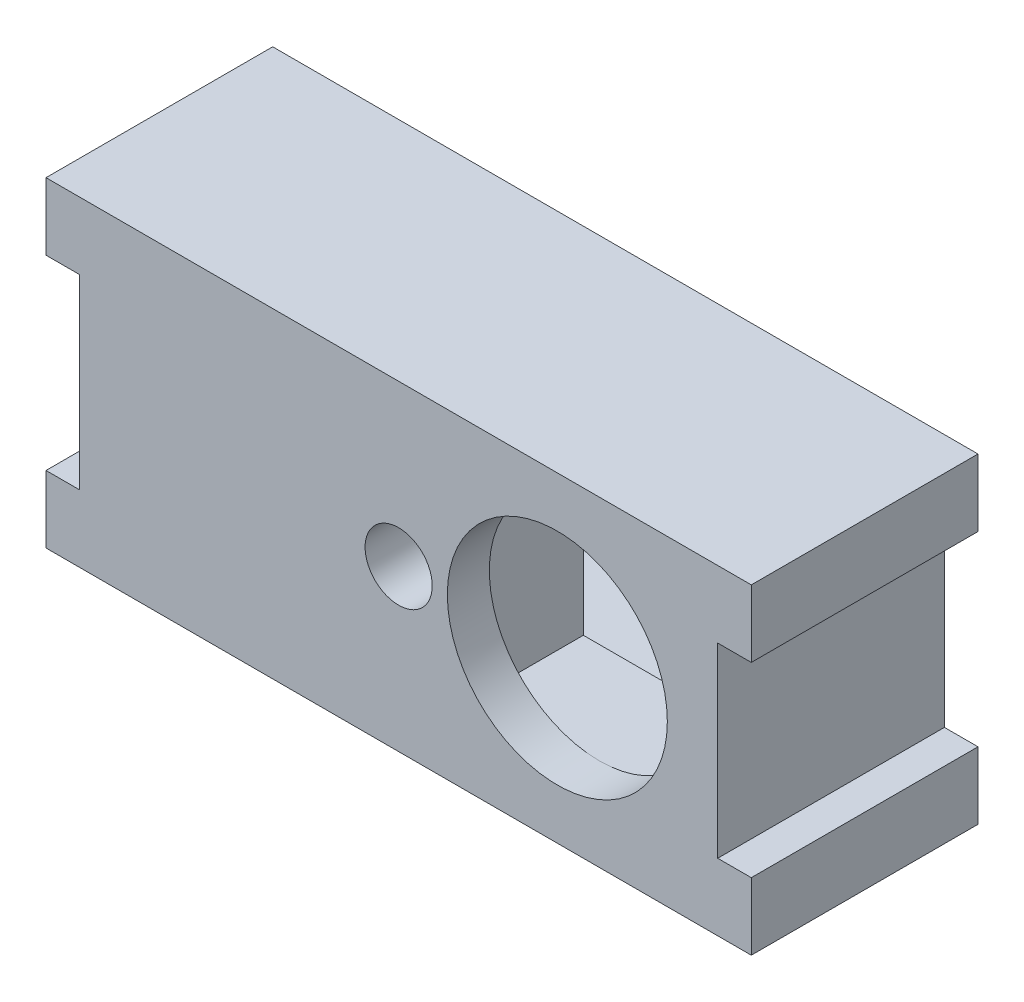
from build123d import *

# Parameters (mm, degrees)
SKETCH2_W           = 38
SKETCH2_H           = 19.1
SKETCH2_R           = 6.55
SKETCH2_R_2         = 2
BOSS_EXTRUDE1_DEPTH = 2.5
SKETCH3_R           = 2
SKETCH3_W           = 13.5
SKETCH3_H           = 13.1
BOSS_EXTRUDE2_DEPTH = 6
BOSS_EXTRUDE3_DEPTH = 5
SKETCH5_W           = 2
SKETCH5_H           = 4
BOSS_EXTRUDE4_DEPTH = 13.5


with BuildPart() as part:
    # Sketch2 → Boss-Extrude1 (new body)
    with BuildSketch(Plane.XY):
        Rectangle(SKETCH2_W, SKETCH2_H)
        with Locations((9.45, 0)):
            Circle(SKETCH2_R, mode=Mode.SUBTRACT)
        Circle(SKETCH2_R_2, mode=Mode.SUBTRACT)
    extrude(amount=-BOSS_EXTRUDE1_DEPTH)

    # Sketch3 → Boss-Extrude2 (add)
    with BuildSketch(Plane(origin=(0, 0, -2.5), x_dir=(-1, 0, 0), z_dir=(0, 0, -1))):
        Polygon((-19, -9.55), (19, -9.55), (19, -5.55), (2.5, -5.55), (2.5, 5.55), (19, 5.55), (19, 9.55), (-19, 9.55), align=None)
        with Locations(Location((0, 0, 0), (0, 0, 180))):
            Circle(SKETCH3_R, mode=Mode.SUBTRACT)
        with Locations((-9.25, 0)):
            Rectangle(SKETCH3_W, SKETCH3_H, mode=Mode.SUBTRACT)
    extrude(amount=BOSS_EXTRUDE2_DEPTH)

    # Sketch4 → Boss-Extrude3 (add)
    with BuildSketch(Plane(origin=(0, 0, -8.5), x_dir=(-1, 0, 0), z_dir=(0, 0, -1))):
        Polygon((19, 5.55), (16.5, 5.55), (16.5, 7.05), (-16.5, 7.05), (-16.5, -7.05), (16.5, -7.05), (16.5, -5.55), (19, -5.55), (19, -9.55), (-19, -9.55), (-19, 9.55), (19, 9.55), align=None)
    extrude(amount=BOSS_EXTRUDE3_DEPTH)

    # Sketch5 → Boss-Extrude4 (add)
    with BuildSketch(Plane(origin=(0, 0, -13.5), x_dir=(-1, 0, 0), z_dir=(0, 0, -1))):
        with Locations((-20, 7.55)):
            Rectangle(SKETCH5_W, SKETCH5_H)
        with Locations((-20, -7.55)):
            Rectangle(SKETCH5_W, SKETCH5_H)
    boss_extrude4 = extrude(amount=-BOSS_EXTRUDE4_DEPTH)

    # Mirror1: Boss-Extrude4 across plane
    add(boss_extrude4.mirror(Plane(origin=(0, 0, 0), x_dir=(0, 0, 1), z_dir=(1, 0, 0))))


solid = part.part
